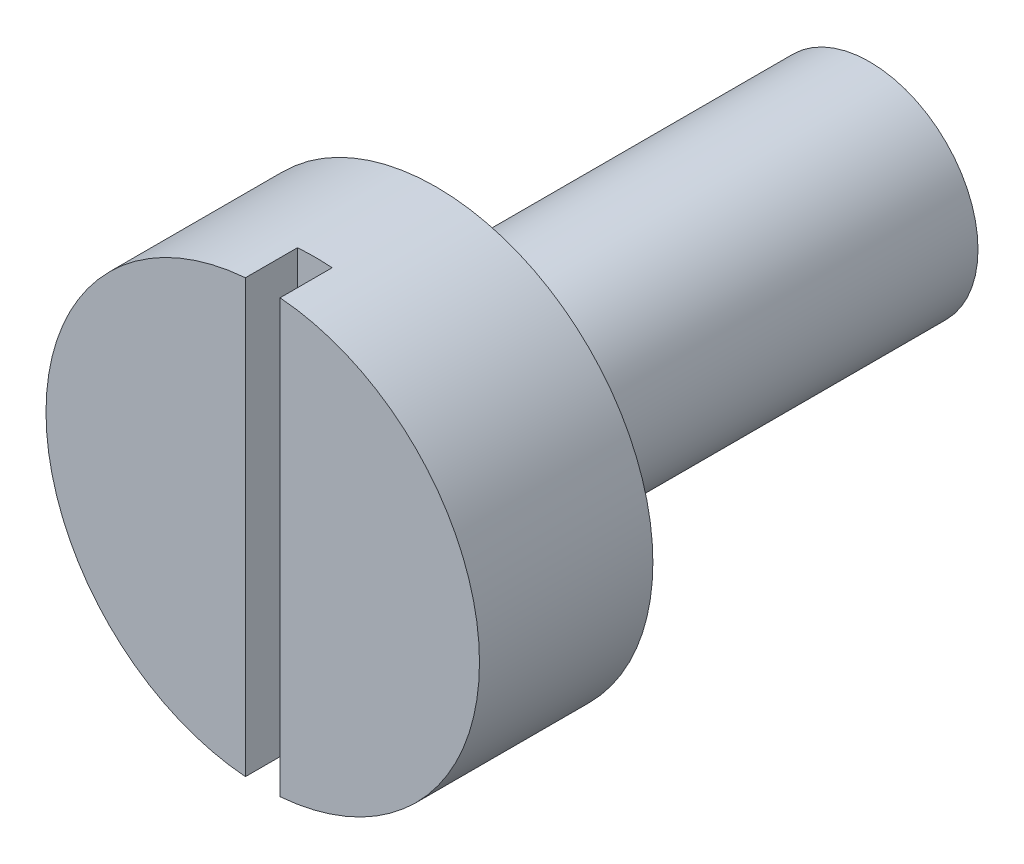
from build123d import *

# Parameters (mm, degrees)
EXTRUDE_1_DEPTH      = 5
EXTRUDE_1_DEPTH_BACK = 5
SKETCH_1_R           = 2.5
SKETCH_2_R           = 5
EXTRUDE_2_DEPTH      = 4
SKETCH_3_W           = 0.8
SKETCH_3_H           = 11.021006482
CUT_EXTRUDE_1_DEPTH  = 1.2


with BuildPart() as part:
    # Эскиз1 → Вытянуть1 (new, two sides: drawn at the far end of the back side and taken through both)
    with BuildSketch(Plane.XY.offset(-EXTRUDE_1_DEPTH_BACK)):
        Circle(SKETCH_1_R)
    extrude(amount=EXTRUDE_1_DEPTH + EXTRUDE_1_DEPTH_BACK)

    # Эскиз2 → Вытянуть2 (add)
    with BuildSketch(Plane.XY.offset(5)):
        Circle(SKETCH_2_R)
    extrude(amount=EXTRUDE_2_DEPTH)

    # Эскиз3 → Вырез-Вытянуть1 (cut)
    with BuildSketch(Plane.XY.offset(9)):
        with Locations((0, 0.044379892)):
            Rectangle(SKETCH_3_W, SKETCH_3_H)
    extrude(amount=-CUT_EXTRUDE_1_DEPTH, mode=Mode.SUBTRACT)


solid = part.part
